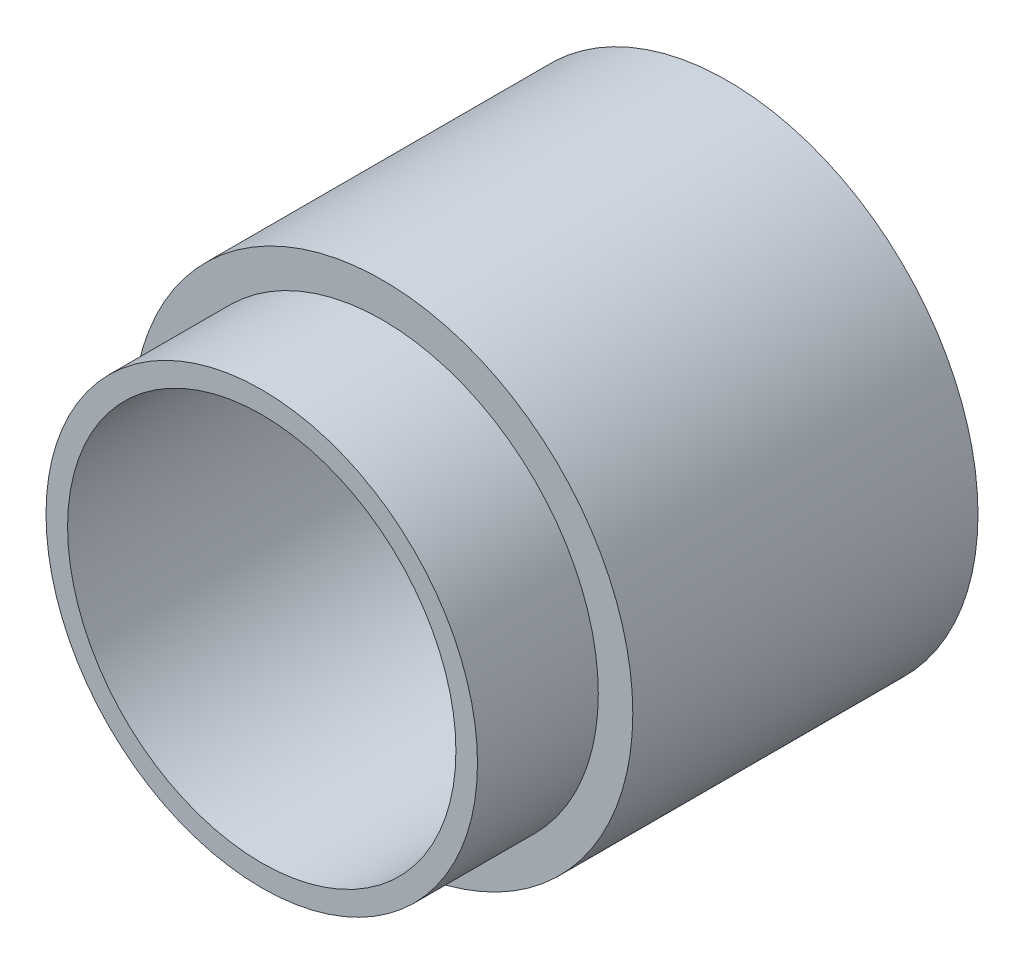
from build123d import *

# Parameters (mm, degrees)
SKETCH1_R           = 14.5
BOSS_EXTRUDE1_DEPTH = 13.5
SKETCH2_OUTSIDE_W   = 40.82
SKETCH2_OUTSIDE_H   = 40.82
SKETCH2_OUTSIDE_R   = 12.5
CUT_EXTRUDE1_DEPTH  = 7
SKETCH3_R           = 11.25
CUT_EXTRUDE2_DEPTH  = 34.904277016


with BuildPart() as part:
    # Sketch1 → Boss-Extrude1 (new, symmetric)
    with BuildSketch(Plane.XY):
        Circle(SKETCH1_R)
    extrude(amount=BOSS_EXTRUDE1_DEPTH, both=True)

    # Sketch2 outside → Cut-Extrude1 (cut)
    with BuildSketch(Plane.XY.offset(13.5)):
        Rectangle(SKETCH2_OUTSIDE_W, SKETCH2_OUTSIDE_H)
        Circle(SKETCH2_OUTSIDE_R, mode=Mode.SUBTRACT)
    extrude(amount=-CUT_EXTRUDE1_DEPTH, mode=Mode.SUBTRACT)

    # Sketch3 → Cut-Extrude2 (cut, through all)
    with BuildSketch(Plane.XY.offset(13.5)):
        Circle(SKETCH3_R)
    extrude(amount=-CUT_EXTRUDE2_DEPTH, mode=Mode.SUBTRACT)


solid = part.part
